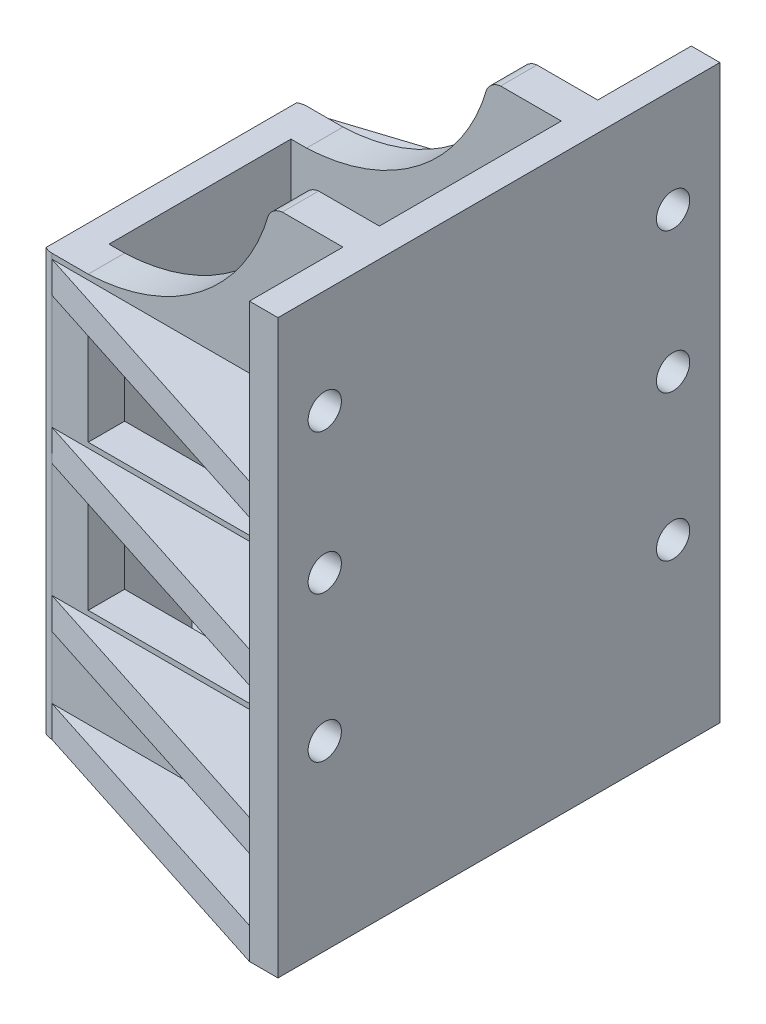
from build123d import *

# Parameters (mm, degrees)
RESSALTO_EXTRUS_O1_DEPTH   = 55
ESBO_O2_W                  = 26
ESBO_O2_H                  = 17.5
CORTE_EXTRUS_O1_DEPTH      = 52
CORTE_EXTRUS_O2_DEPTH      = 29.5
ESBO_O4_W                  = 23
ESBO_O4_H                  = 10
CORTE_EXTRUS_O3_DEPTH      = 52
ESBO_O5_W                  = 20
ESBO_O5_H                  = 16
CORTE_EXTRUS_O4_DEPTH      = 52
RESSALTO_EXTRUS_O3_DEPTH   = 9
RESSALTO_EXTRUS_O4_DEPTH   = 9
CORTE_EXTRUS_O7_DEPTH      = 62.227546905
ESBO_O12_R                 = 1.6
CORTE_EXTRUS_O8_DEPTH      = 66.930360988
CORTE_EXTRUS_O9_DEPTH      = 67.479320093
CORTE_EXTRUS_O9_DEPTH_BACK = 67.479320093


with BuildPart() as part:
    # Esboço1 → Ressalto-extrusão1 (new body)
    with BuildSketch(Plane(origin=(0, 0, 0), x_dir=(1, 0, 0), z_dir=(0, 1, 0))):
        with BuildLine():
            Line((15, 12.25), (16.5, 12.25))
            Line((16.5, 12.25), (16.5, 10.75))
            Line((16.5, 10.75), (16.5, -10.75))
            Line((16.5, -10.75), (16.5, -12.25))
            Line((16.5, -12.25), (15, -12.25))
            Line((15, -12.25), (-15, -12.25))
            ThreePointArc((-15, -12.25), (-16.060660172, -11.810660172), (-16.5, -10.75))
            Line((-16.5, -10.75), (-16.5, 10.75))
            ThreePointArc((-16.5, 10.75), (-16.060660172, 11.810660172), (-15, 12.25))
            Line((-15, 12.25), (15, 12.25))
        make_face()
    extrude(amount=RESSALTO_EXTRUS_O1_DEPTH)

    # Esboço2 → Corte-extrusão1 (cut)
    with BuildSketch(Plane(origin=(0, 55, 0), x_dir=(1, 0, 0), z_dir=(0, 1, 0))):
        Rectangle(ESBO_O2_W, ESBO_O2_H)
    extrude(amount=-CORTE_EXTRUS_O1_DEPTH, mode=Mode.SUBTRACT)

    # Esboço3 → Corte-extrusão2 (cut)
    with BuildSketch(Plane.ZY.offset(16.5)):
        Polygon((-4.25, 8), (0.75, 8), (0.75, 3), (-4.25, 3), (-12.25, 3), (-12.25, 8), align=None)
    extrude(amount=-CORTE_EXTRUS_O2_DEPTH, mode=Mode.SUBTRACT)

    # Esboço4 → Corte-extrusão3 (cut)
    with BuildSketch(Plane(origin=(0, 0, -12.25), x_dir=(-1, 0, 0), z_dir=(0, 0, -1))):
        with Locations((0, 17.5)):
            Rectangle(ESBO_O4_W, ESBO_O4_H)
        with Locations((0, 31.5)):
            Rectangle(ESBO_O4_W, ESBO_O4_H)
        with BuildLine():
            Line((11.5, 40.5), (24.942410125, 40.5))
            Line((24.942410125, 40.5), (24.942410125, 59.834456184))
            Line((24.942410125, 59.834456184), (-1.5, 59.834456184))
            Line((-1.5, 59.834456184), (-6.076098787, 62.09241335))
            Line((-6.076098787, 62.09241335), (-7.576098787, 62.09241335))
            Line((-7.576098787, 62.09241335), (-7.576098787, 57.63082944))
            Line((-7.576098787, 57.63082944), (-16.5, 57.63082944))
            Line((-16.5, 57.63082944), (-16.5, 55))
            Line((-16.5, 55), (-7.576098787, 55))
            Line((-7.576098787, 55), (-7.157696235, 55))
            ThreePointArc((-7.157696235, 55), (-6.380774636, 54.702427517), (-5.834045456, 54.07533601))
            ThreePointArc((-5.834045456, 54.07533601), (0.640063345, 44.48758485), (11.5, 40.5))
        make_face()
    extrude(amount=-CORTE_EXTRUS_O3_DEPTH, mode=Mode.SUBTRACT)

    # Esboço5 → Corte-extrusão4 (cut)
    with BuildSketch(Plane.XZ):
        Rectangle(ESBO_O5_W, ESBO_O5_H)
    extrude(amount=-CORTE_EXTRUS_O4_DEPTH, mode=Mode.SUBTRACT)

    # Esboço6 → Ressalto-extrusão3 (add)
    with BuildSketch(Plane(origin=(0, 0, -12.25), x_dir=(-1, 0, 0), z_dir=(0, 0, -1))):
        Polygon((-16.5, 55), (-13, 55), (-13, 40), (-8.260417548, 40), (15, 40), (15, 37), (-8.260417548, 37), (-13, 37), (-13, 26), (-8.260417548, 26), (15, 26), (15, 23), (-8.260417548, 23), (-13, 23), (-13, 12), (-8.260417548, 12), (15, 12), (15, 9), (-8.260417548, 9), (-13, 9), (-13, 3), (15, 3), (15, 0), (-16.5, 0), align=None)
    extrude(amount=RESSALTO_EXTRUS_O3_DEPTH)

    # Esboço9 → Ressalto-extrusão4 (add)
    with BuildSketch(Plane.XY.offset(12.25)):
        Polygon((13, 23), (13, 12), (8.260417548, 12), (-15, 12), (-15, 9), (8.260417548, 9), (13, 9), (13, 3), (-15, 3), (-15, 0), (16.5, 0), (16.5, 55), (13, 55), (13, 40), (8.260417548, 40), (-15, 40), (-15, 37), (8.260417548, 37), (13, 37), (13, 26), (8.260417548, 26), (-15, 26), (-15, 23), (8.260417548, 23), align=None)
    extrude(amount=RESSALTO_EXTRUS_O4_DEPTH)

    # Esboço11 → Corte-extrusão7 (cut, through all)
    with BuildSketch(Plane(origin=(0, 55, 0), x_dir=(1, 0, 0), z_dir=(0, 1, 0))):
        Polygon((13, 21.25), (-15, 12.25), (-18.396269007, 13.557013), (-20.171014906, 2.968836485), (-21.687729599, -13.92980577), (-19.283641957, -16.807997198), (-15, -12.25), (13, -21.25), (12.387270144, -22.842176527), (-13.733579981, -25.767037441), (-25.593893111, -17.703590231), (-24.101496534, -8.799916531), (-21.404407074, 21.25), (-11.342896145, 26.819075861), (13.346838628, 26.819075861), align=None)
    extrude(amount=-CORTE_EXTRUS_O7_DEPTH, mode=Mode.SUBTRACT)

    # Esboço12 → Corte-extrusão8 (cut, through all)
    with BuildSketch(Plane.ZY.offset(-13)):
        with Locations((-16.75, 45)):
            Circle(ESBO_O12_R)
        with Locations((-16.75, 31.5)):
            Circle(ESBO_O12_R)
        with Locations((-16.75, 17.5)):
            Circle(ESBO_O12_R)
        with Locations((16.75, 17.5)):
            Circle(ESBO_O12_R)
        with Locations((16.75, 31.5)):
            Circle(ESBO_O12_R)
        with Locations((16.75, 45)):
            Circle(ESBO_O12_R)
    extrude(amount=-CORTE_EXTRUS_O8_DEPTH, mode=Mode.SUBTRACT)

    # Esboço13 → Corte-extrusão9 (cut, two sides: drawn at the far end of the back side and taken through both)
    with BuildSketch(Plane(origin=(0, 0, -12.25), x_dir=(-1, 0, 0), z_dir=(0, 0, -1)).offset(-CORTE_EXTRUS_O9_DEPTH_BACK)):
        Polygon((-16, 57.748375369), (-15.75, 57.748375369), (-15.75, -2.748375369), (-16, -2.748375369), (-16.5, -2.748375369), (-21.567741729, -3.81911432), (-26.240802846, 1.764024497), (-29.75124657, 11.630119118), (-32.031223005, 26.530526522), (-32.963463423, 30.826938884), (-36.481605691, 47.040985858), align=None)
        Polygon((16.5, -3.81911432), (16, -3.81911432), (15.75, -9.987267399), (15.75, 53.083012796), (16, 53.083012796), (35.334385386, 35.109894688), (36.940493813, 23.637691641), (28.756988973, 6.505868423), align=None)
    extrude(amount=CORTE_EXTRUS_O9_DEPTH + CORTE_EXTRUS_O9_DEPTH_BACK, mode=Mode.SUBTRACT)


solid = part.part
